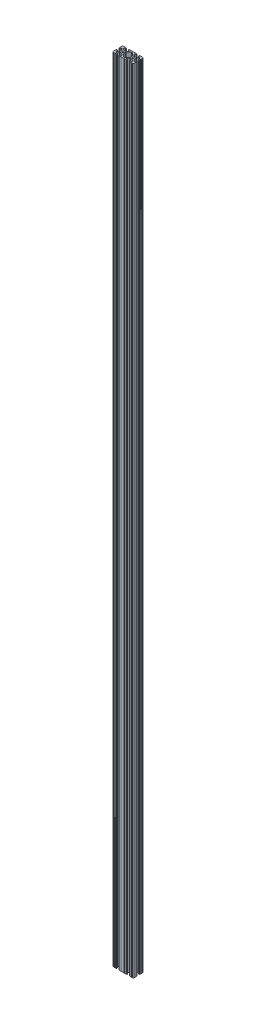
from build123d import *

# Parameters (mm, degrees)
SCHIZZO1_R                   = 3.3274
ESTRUSIONE_ESTRUSIONE1_DEPTH = 2900


with BuildPart() as part:
    # Schizzo1 → Estrusione-Estrusione1 (new body)
    with BuildSketch(Plane(origin=(0, 101.6, 0), x_dir=(1, 0, 0), z_dir=(0, 1, 0))):
        with BuildLine():
            Line((65.520784407, -50.8), (62.992, -50.8))
            ThreePointArc((62.992, -50.8), (61.734764143, -51.320764143), (61.214, -52.578))
            Line((61.214, -52.578), (61.214, -53.086))
            ThreePointArc((61.214, -53.086), (61.734764143, -54.343235857), (62.992, -54.864))
            Line((62.992, -54.864), (66.809477062, -54.864))
            ThreePointArc((66.809477062, -54.864), (67.748138667, -55.491193633), (67.527897552, -56.59842049))
            Line((67.527897552, -56.59842049), (61.776666817, -62.349651224))
            ThreePointArc((61.776666817, -62.349651224), (60.952631511, -62.900254013), (59.980615593, -63.0936))
            Line((59.980615593, -63.0936), (54.319384407, -63.0936))
            ThreePointArc((54.319384407, -63.0936), (53.347368489, -62.900254013), (52.523333183, -62.349651224))
            Line((52.523333183, -62.349651224), (46.772102448, -56.59842049))
            ThreePointArc((46.772102448, -56.59842049), (46.551861333, -55.491193633), (47.490522938, -54.864))
            Line((47.490522938, -54.864), (51.308, -54.864))
            ThreePointArc((51.308, -54.864), (52.565235857, -54.343235857), (53.086, -53.086))
            Line((53.086, -53.086), (53.086, -52.578))
            ThreePointArc((53.086, -52.578), (52.565235857, -51.320764143), (51.308, -50.8))
            Line((51.308, -50.8), (48.641, -50.8))
            ThreePointArc((48.641, -50.8), (48.26, -51.181), (47.879, -50.8))
            Line((47.879, -50.8), (43.561, -50.8))
            ThreePointArc((43.561, -50.8), (43.18, -51.181), (42.799, -50.8))
            Line((42.799, -50.8), (33.401, -50.8))
            ThreePointArc((33.401, -50.8), (33.02, -51.181), (32.639, -50.8))
            Line((32.639, -50.8), (28.321, -50.8))
            ThreePointArc((28.321, -50.8), (27.94, -51.181), (27.559, -50.8))
            Line((27.559, -50.8), (24.892, -50.8))
            ThreePointArc((24.892, -50.8), (23.634764143, -51.320764143), (23.114, -52.578))
            Line((23.114, -52.578), (23.114, -53.086))
            ThreePointArc((23.114, -53.086), (23.634764143, -54.343235857), (24.892, -54.864))
            Line((24.892, -54.864), (28.709477062, -54.864))
            ThreePointArc((28.709477062, -54.864), (29.648138667, -55.491193633), (29.427897552, -56.59842049))
            Line((29.427897552, -56.59842049), (23.676666817, -62.349651224))
            ThreePointArc((23.676666817, -62.349651224), (22.852631511, -62.900254013), (21.880615593, -63.0936))
            Line((21.880615593, -63.0936), (16.219384407, -63.0936))
            ThreePointArc((16.219384407, -63.0936), (15.247368489, -62.900254013), (14.423333183, -62.349651224))
            Line((14.423333183, -62.349651224), (8.672102448, -56.59842049))
            ThreePointArc((8.672102448, -56.59842049), (8.451861333, -55.491193633), (9.390522938, -54.864))
            Line((9.390522938, -54.864), (13.208, -54.864))
            ThreePointArc((13.208, -54.864), (14.465235857, -54.343235857), (14.986, -53.086))
            Line((14.986, -53.086), (14.986, -52.578))
            ThreePointArc((14.986, -52.578), (14.465235857, -51.320764143), (13.208, -50.8))
            Line((13.208, -50.8), (10.402784407, -50.8))
            ThreePointArc((10.402784407, -50.8), (10.021784407, -51.181), (9.640784407, -50.8))
            Line((9.640784407, -50.8), (5.322784407, -50.8))
            ThreePointArc((5.322784407, -50.8), (4.941784407, -51.181), (4.560784407, -50.8))
            Line((4.560784407, -50.8), (2.54, -50.8))
            ThreePointArc((2.54, -50.8), (0.743948776, -51.543948776), (0, -53.34))
            Line((0, -53.34), (0, -55.499))
            ThreePointArc((0, -55.499), (0.381, -55.88), (0, -56.261))
            Line((0, -56.261), (0, -60.579))
            ThreePointArc((0, -60.579), (0.381, -60.96), (0, -61.341))
            Line((0, -61.341), (0, -64.008))
            ThreePointArc((0, -64.008), (0.520764143, -65.265235857), (1.778, -65.786))
            Line((1.778, -65.786), (2.286, -65.786))
            ThreePointArc((2.286, -65.786), (3.543235857, -65.265235857), (4.064, -64.008))
            Line((4.064, -64.008), (4.064, -60.190522938))
            ThreePointArc((4.064, -60.190522938), (4.691193633, -59.251861333), (5.79842049, -59.472102448))
            Line((5.79842049, -59.472102448), (11.549651224, -65.223333183))
            ThreePointArc((11.549651224, -65.223333183), (12.100254013, -66.047368489), (12.2936, -67.019384407))
            Line((12.2936, -67.019384407), (12.2936, -72.680615593))
            ThreePointArc((12.2936, -72.680615593), (12.100254013, -73.652631511), (11.549651224, -74.476666817))
            Line((11.549651224, -74.476666817), (5.79842049, -80.227897552))
            ThreePointArc((5.79842049, -80.227897552), (4.691193633, -80.448138667), (4.064, -79.509477062))
            Line((4.064, -79.509477062), (4.064, -75.692))
            ThreePointArc((4.064, -75.692), (3.543235857, -74.434764143), (2.286, -73.914))
            Line((2.286, -73.914), (1.778, -73.914))
            ThreePointArc((1.778, -73.914), (0.520764143, -74.434764143), (0, -75.692))
            Line((0, -75.692), (0, -78.497215593))
            ThreePointArc((0, -78.497215593), (0.381, -78.878215593), (0, -79.259215593))
            Line((0, -79.259215593), (0, -83.577215593))
            ThreePointArc((0, -83.577215593), (0.381, -83.958215593), (0, -84.339215593))
            Line((0, -84.339215593), (0, -86.36))
            ThreePointArc((0, -86.36), (0.743948776, -88.156051224), (2.54, -88.9))
            Line((2.54, -88.9), (4.699, -88.9))
            ThreePointArc((4.699, -88.9), (5.08, -88.519), (5.461, -88.9))
            Line((5.461, -88.9), (9.779, -88.9))
            ThreePointArc((9.779, -88.9), (10.16, -88.519), (10.541, -88.9))
            Line((10.541, -88.9), (13.208, -88.9))
            ThreePointArc((13.208, -88.9), (14.465235857, -88.379235857), (14.986, -87.122))
            Line((14.986, -87.122), (14.986, -86.614))
            ThreePointArc((14.986, -86.614), (14.465235857, -85.356764143), (13.208, -84.836))
            Line((13.208, -84.836), (9.390522938, -84.836))
            ThreePointArc((9.390522938, -84.836), (8.451861333, -84.208806367), (8.672102448, -83.10157951))
            Line((8.672102448, -83.10157951), (14.423333183, -77.350348776))
            ThreePointArc((14.423333183, -77.350348776), (15.247368489, -76.799745987), (16.219384407, -76.6064))
            Line((16.219384407, -76.6064), (21.880615593, -76.6064))
            ThreePointArc((21.880615593, -76.6064), (22.852631511, -76.799745987), (23.676666817, -77.350348776))
            Line((23.676666817, -77.350348776), (29.427897552, -83.10157951))
            ThreePointArc((29.427897552, -83.10157951), (29.648138667, -84.208806367), (28.709477062, -84.836))
            Line((28.709477062, -84.836), (24.892, -84.836))
            ThreePointArc((24.892, -84.836), (23.634764143, -85.356764143), (23.114, -86.614))
            Line((23.114, -86.614), (23.114, -87.122))
            ThreePointArc((23.114, -87.122), (23.634764143, -88.379235857), (24.892, -88.9))
            Line((24.892, -88.9), (27.697215593, -88.9))
            ThreePointArc((27.697215593, -88.9), (28.078215593, -88.519), (28.459215593, -88.9))
            Line((28.459215593, -88.9), (32.777215593, -88.9))
            ThreePointArc((32.777215593, -88.9), (33.158215593, -88.519), (33.539215593, -88.9))
            Line((33.539215593, -88.9), (42.937215593, -88.9))
            ThreePointArc((42.937215593, -88.9), (43.318215593, -88.519), (43.699215593, -88.9))
            Line((43.699215593, -88.9), (48.017215593, -88.9))
            ThreePointArc((48.017215593, -88.9), (48.398215593, -88.519), (48.779215593, -88.9))
            Line((48.779215593, -88.9), (51.308, -88.9))
            ThreePointArc((51.308, -88.9), (52.565235857, -88.379235857), (53.086, -87.122))
            Line((53.086, -87.122), (53.086, -86.614))
            ThreePointArc((53.086, -86.614), (52.565235857, -85.356764143), (51.308, -84.836))
            Line((51.308, -84.836), (47.490522938, -84.836))
            ThreePointArc((47.490522938, -84.836), (46.551861333, -84.208806367), (46.772102448, -83.10157951))
            Line((46.772102448, -83.10157951), (52.523333183, -77.350348776))
            ThreePointArc((52.523333183, -77.350348776), (53.347368489, -76.799745987), (54.319384407, -76.6064))
            Line((54.319384407, -76.6064), (59.980615593, -76.6064))
            ThreePointArc((59.980615593, -76.6064), (60.952631511, -76.799745987), (61.776666817, -77.350348776))
            Line((61.776666817, -77.350348776), (67.527897552, -83.10157951))
            ThreePointArc((67.527897552, -83.10157951), (67.748138667, -84.208806367), (66.809477062, -84.836))
            Line((66.809477062, -84.836), (62.992, -84.836))
            ThreePointArc((62.992, -84.836), (61.734764143, -85.356764143), (61.214, -86.614))
            Line((61.214, -86.614), (61.214, -87.122))
            ThreePointArc((61.214, -87.122), (61.734764143, -88.379235857), (62.992, -88.9))
            Line((62.992, -88.9), (65.659, -88.9))
            ThreePointArc((65.659, -88.9), (66.04, -88.519), (66.421, -88.9))
            Line((66.421, -88.9), (70.739, -88.9))
            ThreePointArc((70.739, -88.9), (71.12, -88.519), (71.501, -88.9))
            Line((71.501, -88.9), (73.66, -88.9))
            ThreePointArc((73.66, -88.9), (75.456051224, -88.156051224), (76.2, -86.36))
            Line((76.2, -86.36), (76.2, -84.062784407))
            ThreePointArc((76.2, -84.062784407), (75.819, -83.681784407), (76.2, -83.300784407))
            Line((76.2, -83.300784407), (76.2, -78.982784407))
            ThreePointArc((76.2, -78.982784407), (75.819, -78.601784407), (76.2, -78.220784407))
            Line((76.2, -78.220784407), (76.2, -75.692))
            ThreePointArc((76.2, -75.692), (75.679235857, -74.434764143), (74.422, -73.914))
            Line((74.422, -73.914), (73.914, -73.914))
            ThreePointArc((73.914, -73.914), (72.656764143, -74.434764143), (72.136, -75.692))
            Line((72.136, -75.692), (72.136, -79.509477062))
            ThreePointArc((72.136, -79.509477062), (71.508806367, -80.448138667), (70.40157951, -80.227897552))
            Line((70.40157951, -80.227897552), (64.650348776, -74.476666817))
            ThreePointArc((64.650348776, -74.476666817), (64.099745987, -73.652631511), (63.9064, -72.680615593))
            Line((63.9064, -72.680615593), (63.9064, -67.019384407))
            ThreePointArc((63.9064, -67.019384407), (64.099745987, -66.047368489), (64.650348776, -65.223333183))
            Line((64.650348776, -65.223333183), (70.40157951, -59.472102448))
            ThreePointArc((70.40157951, -59.472102448), (71.508806367, -59.251861333), (72.136, -60.190522938))
            Line((72.136, -60.190522938), (72.136, -64.008))
            ThreePointArc((72.136, -64.008), (72.656764143, -65.265235857), (73.914, -65.786))
            Line((73.914, -65.786), (74.422, -65.786))
            ThreePointArc((74.422, -65.786), (75.679235857, -65.265235857), (76.2, -64.008))
            Line((76.2, -64.008), (76.2, -61.341))
            ThreePointArc((76.2, -61.341), (75.819, -60.96), (76.2, -60.579))
            Line((76.2, -60.579), (76.2, -56.261))
            ThreePointArc((76.2, -56.261), (75.819, -55.88), (76.2, -55.499))
            Line((76.2, -55.499), (76.2, -53.34))
            ThreePointArc((76.2, -53.34), (75.456051224, -51.543948776), (73.66, -50.8))
            Line((73.66, -50.8), (71.362784407, -50.8))
            ThreePointArc((71.362784407, -50.8), (70.981784407, -51.181), (70.600784407, -50.8))
            Line((70.600784407, -50.8), (66.282784407, -50.8))
            ThreePointArc((66.282784407, -50.8), (65.901784407, -51.181), (65.520784407, -50.8))
        make_face()
        with Locations(Location((57.15, -69.85, 0), (0, 0, 90))):
            Circle(SCHIZZO1_R, mode=Mode.SUBTRACT)
        with Locations(Location((19.05, -69.85, 0), (0, 0, 90))):
            Circle(SCHIZZO1_R, mode=Mode.SUBTRACT)
        with BuildLine():
            Line((38.238215593, -84.836), (37.961784407, -84.836))
            ThreePointArc((37.961784407, -84.836), (36.989768489, -84.642654013), (36.165733183, -84.092051224))
            Line((36.165733183, -84.092051224), (26.550348776, -74.476666817))
            ThreePointArc((26.550348776, -74.476666817), (25.999745987, -73.652631511), (25.8064, -72.680615593))
            Line((25.8064, -72.680615593), (25.8064, -67.019384407))
            ThreePointArc((25.8064, -67.019384407), (25.999745987, -66.047368489), (26.550348776, -65.223333183))
            Line((26.550348776, -65.223333183), (36.165733183, -55.607948776))
            ThreePointArc((36.165733183, -55.607948776), (36.989768489, -55.057345987), (37.961784407, -54.864))
            Line((37.961784407, -54.864), (38.238215593, -54.864))
            ThreePointArc((38.238215593, -54.864), (39.210231511, -55.057345987), (40.034266817, -55.607948776))
            Line((40.034266817, -55.607948776), (49.649651224, -65.223333183))
            ThreePointArc((49.649651224, -65.223333183), (50.200254013, -66.047368489), (50.3936, -67.019384407))
            Line((50.3936, -67.019384407), (50.3936, -72.680615593))
            ThreePointArc((50.3936, -72.680615593), (50.200254013, -73.652631511), (49.649651224, -74.476666817))
            Line((49.649651224, -74.476666817), (40.034266817, -84.092051224))
            ThreePointArc((40.034266817, -84.092051224), (39.210231511, -84.642654013), (38.238215593, -84.836))
        make_face(mode=Mode.SUBTRACT)
    extrude(amount=-ESTRUSIONE_ESTRUSIONE1_DEPTH)


solid = part.part
